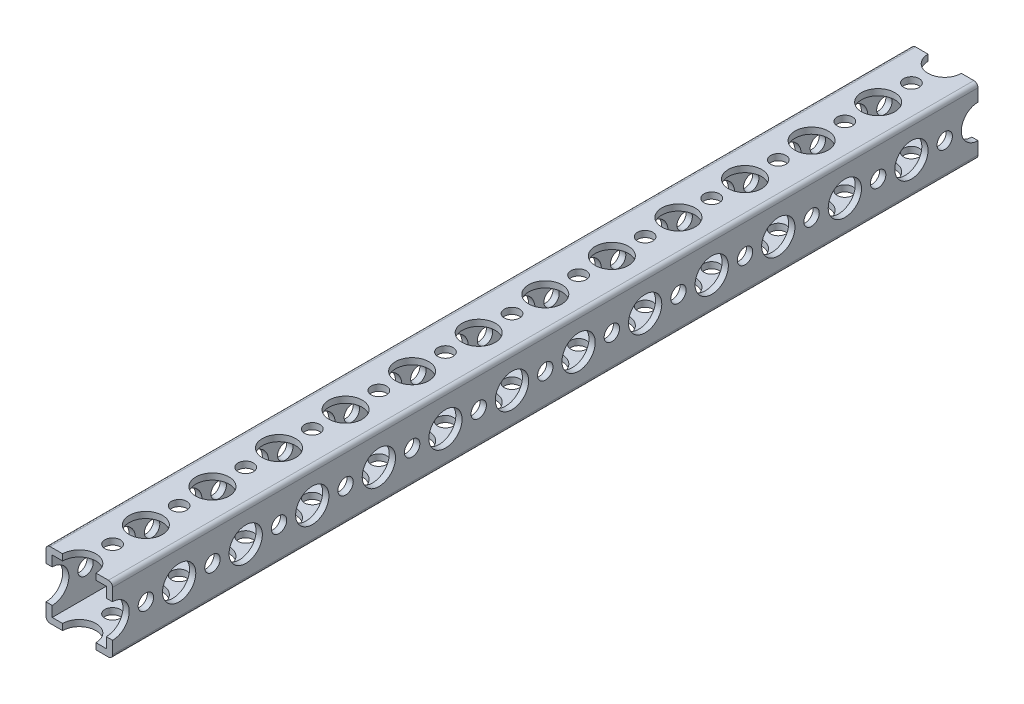
from build123d import *

# Parameters (mm, degrees)
SKETCH1_W      = 16
SKETCH1_H      = 16
EXTRUDE1_DEPTH = 208
SKETCH2_W      = 13
SKETCH2_H      = 13
EXTRUDE2_DEPTH = 210.22714929
SKETCH3_R      = 4
SKETCH3_R_2    = 1.85
EXTRUDE3_DEPTH = 210.22714929
SKETCH4_R      = 4
SKETCH4_R_2    = 1.85
EXTRUDE4_DEPTH = 210.22714929
FILLET1_R      = 1


with BuildPart() as part:
    # Sketch1 → Extrude1 (new body)
    with BuildSketch(Plane.XY):
        with Locations((8, 8)):
            Rectangle(SKETCH1_W, SKETCH1_H)
    extrude(amount=-EXTRUDE1_DEPTH)

    # Sketch2 → Extrude2 (cut, through all)
    with BuildSketch(Plane.XY):
        with Locations((8, 8)):
            Rectangle(SKETCH2_W, SKETCH2_H)
    extrude(amount=-EXTRUDE2_DEPTH, mode=Mode.SUBTRACT)

    # Sketch3 → Extrude3 (cut, through all)
    with BuildSketch(Plane(origin=(0, 16, 0), x_dir=(1, 0, 0), z_dir=(0, 1, 0))):
        with Locations(Location((8, 64, 0), (0, 0, 270))):
            Circle(SKETCH3_R)
        with Locations(Location((8, 32, 0), (0, 0, 270))):
            Circle(SKETCH3_R)
        with Locations((8, 0)):
            Circle(SKETCH3_R)
        with Locations(Location((8, 96, 0), (0, 0, 270))):
            Circle(SKETCH3_R)
        with Locations(Location((8, 128, 0), (0, 0, 270))):
            Circle(SKETCH3_R)
        with Locations(Location((8, 160, 0), (0, 0, 270))):
            Circle(SKETCH3_R)
        with Locations(Location((8, 192, 0), (0, 0, 270))):
            Circle(SKETCH3_R)
        with Locations((8, 224)):
            Circle(SKETCH3_R)
        with Locations((8, 256)):
            Circle(SKETCH3_R)
        with Locations(Location((8, 48, 0), (0, 0, 270))):
            Circle(SKETCH3_R)
        with Locations(Location((8, 56, 0), (0, 0, 270))):
            Circle(SKETCH3_R_2)
        with Locations(Location((8, 40, 0), (0, 0, 270))):
            Circle(SKETCH3_R_2)
        with Locations(Location((8, 80, 0), (0, 0, 270))):
            Circle(SKETCH3_R)
        with Locations(Location((8, 88, 0), (0, 0, 270))):
            Circle(SKETCH3_R_2)
        with Locations(Location((8, 72, 0), (0, 0, 270))):
            Circle(SKETCH3_R_2)
        with Locations(Location((8, 16, 0), (0, 0, 270))):
            Circle(SKETCH3_R)
        with Locations(Location((8, 24, 0), (0, 0, 270))):
            Circle(SKETCH3_R_2)
        with Locations(Location((8, 8, 0), (0, 0, 270))):
            Circle(SKETCH3_R_2)
        with Locations(Location((8, 112, 0), (0, 0, 270))):
            Circle(SKETCH3_R)
        with Locations(Location((8, 120, 0), (0, 0, 270))):
            Circle(SKETCH3_R_2)
        with Locations(Location((8, 104, 0), (0, 0, 270))):
            Circle(SKETCH3_R_2)
        with Locations(Location((8, 144, 0), (0, 0, 270))):
            Circle(SKETCH3_R)
        with Locations(Location((8, 152, 0), (0, 0, 270))):
            Circle(SKETCH3_R_2)
        with Locations(Location((8, 136, 0), (0, 0, 270))):
            Circle(SKETCH3_R_2)
        with Locations(Location((8, 176, 0), (0, 0, 270))):
            Circle(SKETCH3_R)
        with Locations(Location((8, 184, 0), (0, 0, 270))):
            Circle(SKETCH3_R_2)
        with Locations(Location((8, 168, 0), (0, 0, 270))):
            Circle(SKETCH3_R_2)
        with Locations((8, 208)):
            Circle(SKETCH3_R)
        with Locations((8, 216)):
            Circle(SKETCH3_R_2)
        with Locations(Location((8, 200, 0), (0, 0, 270))):
            Circle(SKETCH3_R_2)
        with Locations((8, 240)):
            Circle(SKETCH3_R)
        with Locations((8, 248)):
            Circle(SKETCH3_R_2)
        with Locations((8, 232)):
            Circle(SKETCH3_R_2)
    extrude(amount=-EXTRUDE3_DEPTH, mode=Mode.SUBTRACT)

    # Sketch4 → Extrude4 (cut, through all)
    with BuildSketch(Plane(origin=(16, 0, 0), x_dir=(0, 0, -1), z_dir=(1, 0, 0))):
        with Locations(Location((32, 8, 0), (0, 0, 90))):
            Circle(SKETCH4_R)
        with Locations(Location((64, 8, 0), (0, 0, 90))):
            Circle(SKETCH4_R)
        with Locations((0, 8)):
            Circle(SKETCH4_R)
        with Locations(Location((96, 8, 0), (0, 0, 90))):
            Circle(SKETCH4_R)
        with Locations(Location((128, 8, 0), (0, 0, 90))):
            Circle(SKETCH4_R)
        with Locations(Location((160, 8, 0), (0, 0, 90))):
            Circle(SKETCH4_R)
        with Locations(Location((192, 8, 0), (0, 0, 90))):
            Circle(SKETCH4_R)
        with Locations((224, 8)):
            Circle(SKETCH4_R)
        with Locations((256, 8)):
            Circle(SKETCH4_R)
        with Locations(Location((48, 8.074203, 0), (0, 0, 90))):
            Circle(SKETCH4_R)
        with Locations(Location((40, 8.074203, 0), (0, 0, 90))):
            Circle(SKETCH4_R_2)
        with Locations(Location((56, 8.074203, 0), (0, 0, 90))):
            Circle(SKETCH4_R_2)
        with Locations(Location((80, 8, 0), (0, 0, 90))):
            Circle(SKETCH4_R)
        with Locations(Location((72, 8, 0), (0, 0, 90))):
            Circle(SKETCH4_R_2)
        with Locations(Location((88, 8, 0), (0, 0, 90))):
            Circle(SKETCH4_R_2)
        with Locations(Location((16, 8, 0), (0, 0, 90))):
            Circle(SKETCH4_R)
        with Locations(Location((8, 8, 0), (0, 0, 90))):
            Circle(SKETCH4_R_2)
        with Locations(Location((24, 8, 0), (0, 0, 90))):
            Circle(SKETCH4_R_2)
        with Locations(Location((112, 8, 0), (0, 0, 90))):
            Circle(SKETCH4_R)
        with Locations(Location((104, 8, 0), (0, 0, 90))):
            Circle(SKETCH4_R_2)
        with Locations(Location((120, 8, 0), (0, 0, 90))):
            Circle(SKETCH4_R_2)
        with Locations(Location((144, 8, 0), (0, 0, 90))):
            Circle(SKETCH4_R)
        with Locations(Location((136, 8, 0), (0, 0, 90))):
            Circle(SKETCH4_R_2)
        with Locations(Location((152, 8, 0), (0, 0, 90))):
            Circle(SKETCH4_R_2)
        with Locations(Location((176, 8, 0), (0, 0, 90))):
            Circle(SKETCH4_R)
        with Locations(Location((168, 8, 0), (0, 0, 90))):
            Circle(SKETCH4_R_2)
        with Locations(Location((184, 8, 0), (0, 0, 90))):
            Circle(SKETCH4_R_2)
        with Locations((208, 8)):
            Circle(SKETCH4_R)
        with Locations(Location((200, 8, 0), (0, 0, 90))):
            Circle(SKETCH4_R_2)
        with Locations((216, 8)):
            Circle(SKETCH4_R_2)
        with Locations((240, 8)):
            Circle(SKETCH4_R)
        with Locations((232, 8)):
            Circle(SKETCH4_R_2)
        with Locations((248, 8)):
            Circle(SKETCH4_R_2)
    extrude(amount=-EXTRUDE4_DEPTH, mode=Mode.SUBTRACT)

    # Fillet1
    fillet1_edges = [part.edges().sort_by_distance(p)[0] for p in [
        (0, 16, -104),
        (16, 16, -104),
        (16, 0, -104),
        (0, 0, -104),
    ]]
    fillet(fillet1_edges, radius=FILLET1_R)


solid = part.part
